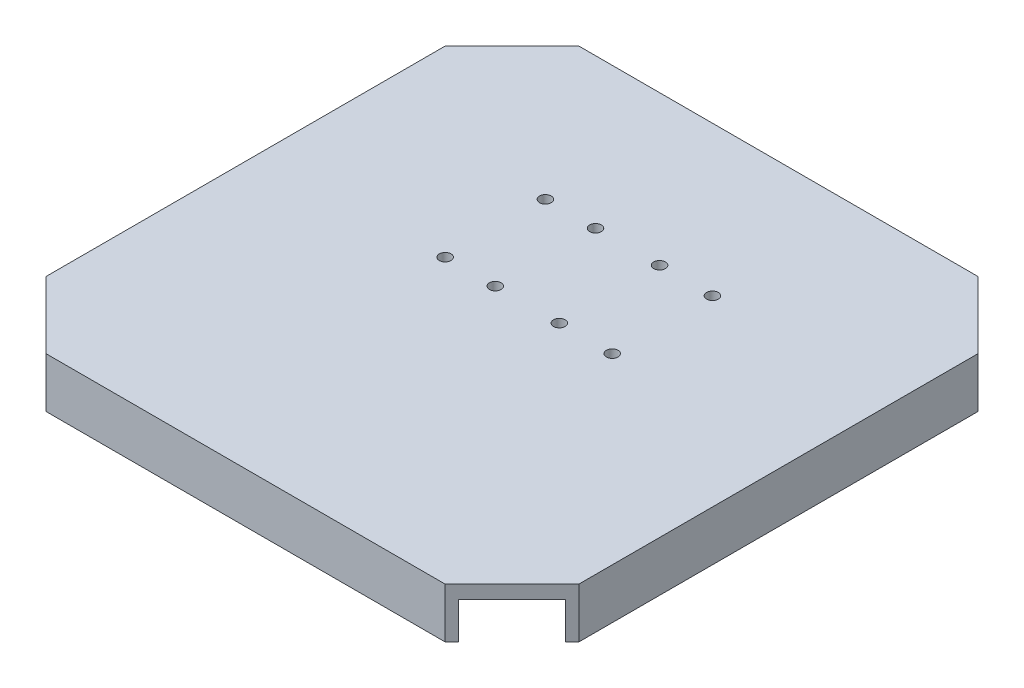
from build123d import *

# Parameters (mm, degrees)
BOSS_EXTRUDE1_DEPTH = 15
SKETCH5_W           = 155.5
SKETCH5_H           = 155.5
CUT_EXTRUDE3_DEPTH  = 11
SKETCH7_R           = 1.75
CUT_EXTRUDE4_DEPTH  = 2.5


with BuildPart() as part:
    # Sketch1 → Boss-Extrude1 (new body)
    with BuildSketch(Plane(origin=(0, 0, 0), x_dir=(1, 0, 0), z_dir=(0, 1, 0))):
        Polygon((20, 159.5), (0, 139.5), (0, 20), (20, 0), (139.5, 0), (159.5, 20), (159.5, 139.5), (139.5, 159.5), align=None)
    extrude(amount=BOSS_EXTRUDE1_DEPTH)

    # Sketch5 → Cut-Extrude3 (cut)
    with BuildSketch(Plane.XZ):
        with Locations((79.75, -79.75)):
            Rectangle(SKETCH5_W, SKETCH5_H)
    extrude(amount=-CUT_EXTRUDE3_DEPTH, mode=Mode.SUBTRACT)

    # Sketch7 → Cut-Extrude4 (cut)
    with BuildSketch(Plane(origin=(0, 15, 0), x_dir=(1, 0, 0), z_dir=(0, 1, 0))):
        with Locations(Location((54.75, 114.75, 0), (0, 0, 270))):
            Circle(SKETCH7_R)
        with Locations(Location((104.75, 114.75, 0), (0, 0, 90))):
            Circle(SKETCH7_R)
        with Locations(Location((69.75, 114.75, 0), (0, 0, 270))):
            Circle(SKETCH7_R)
        with Locations(Location((88.92664449, 114.75, 0), (0, 0, 270))):
            Circle(SKETCH7_R)
        with Locations(Location((54.75, 84.75, 0), (0, 0, 270))):
            Circle(SKETCH7_R)
        with Locations(Location((69.75, 84.75, 0), (0, 0, 270))):
            Circle(SKETCH7_R)
        with Locations(Location((88.92664449, 84.75, 0), (0, 0, 270))):
            Circle(SKETCH7_R)
        with Locations(Location((104.75, 84.75, 0), (0, 0, 90))):
            Circle(SKETCH7_R)
    extrude(amount=-CUT_EXTRUDE4_DEPTH, mode=Mode.SUBTRACT)


solid = part.part
